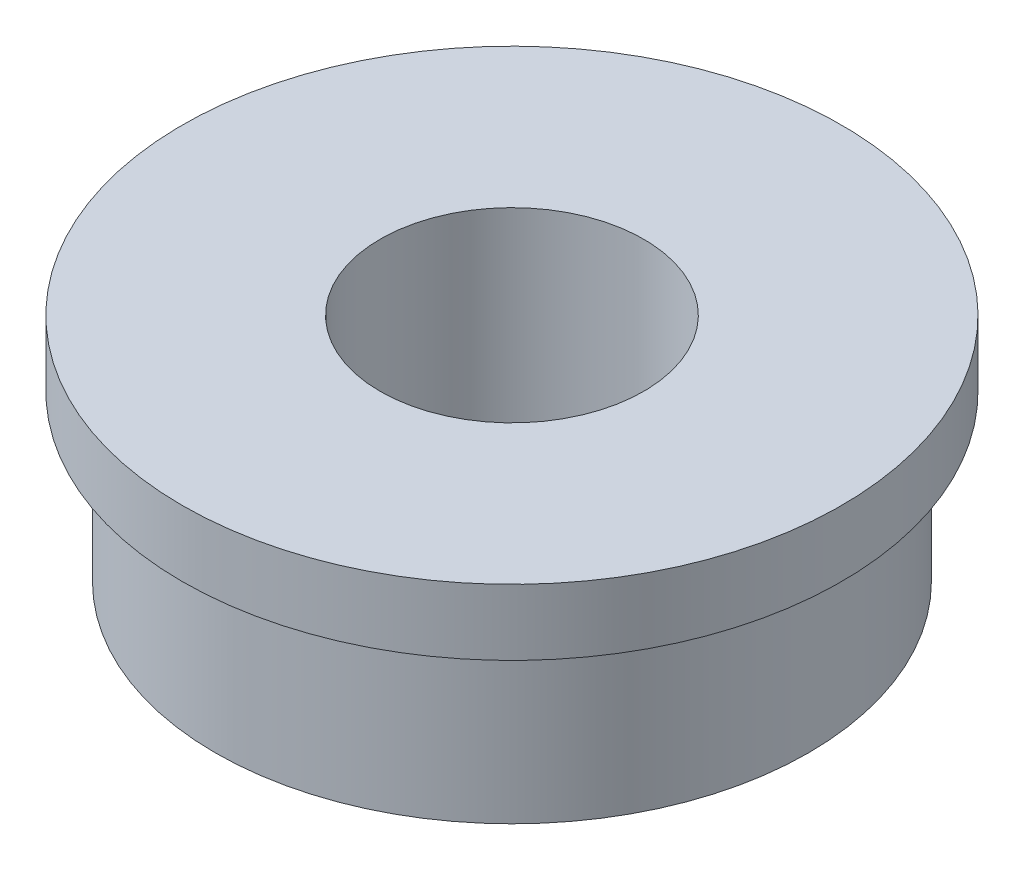
from build123d import *

# Parameters (mm, degrees)
SKETCH1_R           = 14.2875
BOSS_EXTRUDE1_DEPTH = 11.1125
SKETCH2_R           = 15.875
BOSS_EXTRUDE2_DEPTH = 3.175
SKETCH3_R           = 6.35
CUT_EXTRUDE1_DEPTH  = 26.050327468


with BuildPart() as part:
    # Sketch1 → Boss-Extrude1 (new body)
    with BuildSketch(Plane(origin=(0, 0, 0), x_dir=(1, 0, 0), z_dir=(0, 1, 0))):
        with Locations(Location((0, 0, 0), (0, 0, 270))):
            Circle(SKETCH1_R)
    extrude(amount=BOSS_EXTRUDE1_DEPTH)

    # Sketch2 → Boss-Extrude2 (add)
    with BuildSketch(Plane(origin=(0, 11.1125, 0), x_dir=(1, 0, 0), z_dir=(0, 1, 0))):
        with Locations(Location((0, 0, 0), (0, 0, 270))):
            Circle(SKETCH2_R)
    extrude(amount=-BOSS_EXTRUDE2_DEPTH)

    # Sketch3 → Cut-Extrude1 (cut, through all)
    with BuildSketch(Plane(origin=(0, 11.1125, 0), x_dir=(1, 0, 0), z_dir=(0, 1, 0))):
        with Locations(Location((0, 0, 0), (0, 0, 270))):
            Circle(SKETCH3_R)
    extrude(amount=-CUT_EXTRUDE1_DEPTH, mode=Mode.SUBTRACT)


solid = part.part
